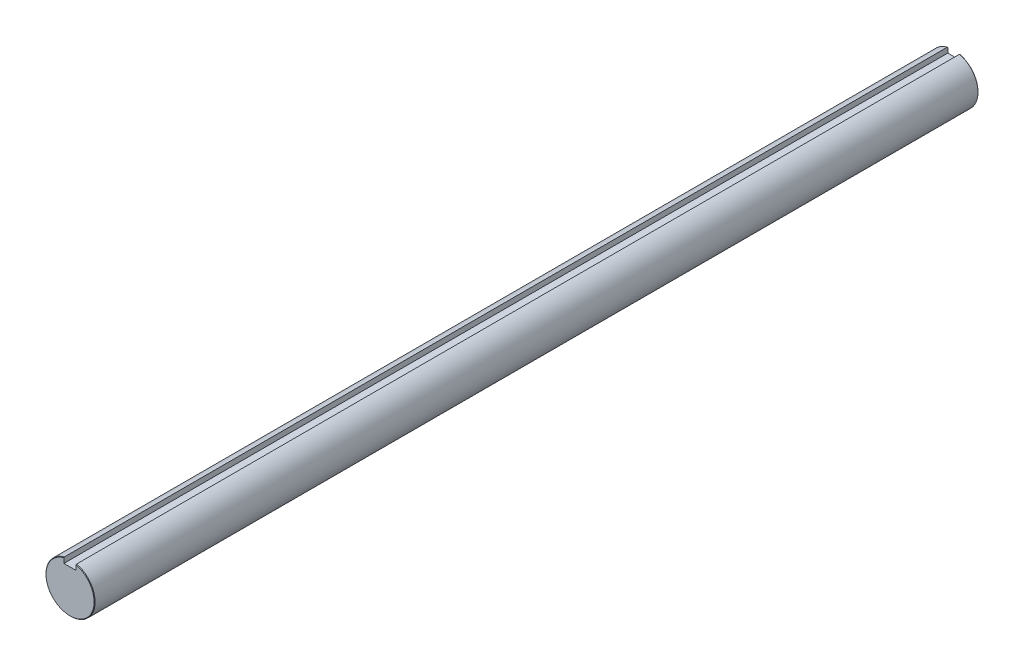
from build123d import *

# Parameters (mm, degrees)
BOSS_EXTRUDE1_DEPTH      = 114.3
BOSS_EXTRUDE1_DEPTH_BACK = 114.3
CHAMFER1_SIZE            = 0.127


with BuildPart() as part:
    # Sketch3 → Boss-Extrude1 (new, two sides: drawn at the far end of the back side and taken through both)
    with BuildSketch(Plane.XY.offset(-BOSS_EXTRUDE1_DEPTH_BACK)):
        with BuildLine():
            Line((-1.5875, 4.7498), (-1.5875, 6.148361062))
            ThreePointArc((-1.5875, 6.148361062), (0, -6.35), (1.5875, 6.148361062))
            Line((1.5875, 6.148361062), (1.5875, 4.7498))
            Line((1.5875, 4.7498), (-1.5875, 4.7498))
        make_face()
    extrude(amount=BOSS_EXTRUDE1_DEPTH + BOSS_EXTRUDE1_DEPTH_BACK)

    # Chamfer1
    chamfer1_edges = [part.edges().sort_by_distance(p)[0] for p in [
        (0, -6.35, -114.3),
        (0, -6.35, 114.3),
    ]]
    chamfer(chamfer1_edges, length=CHAMFER1_SIZE)


solid = part.part
